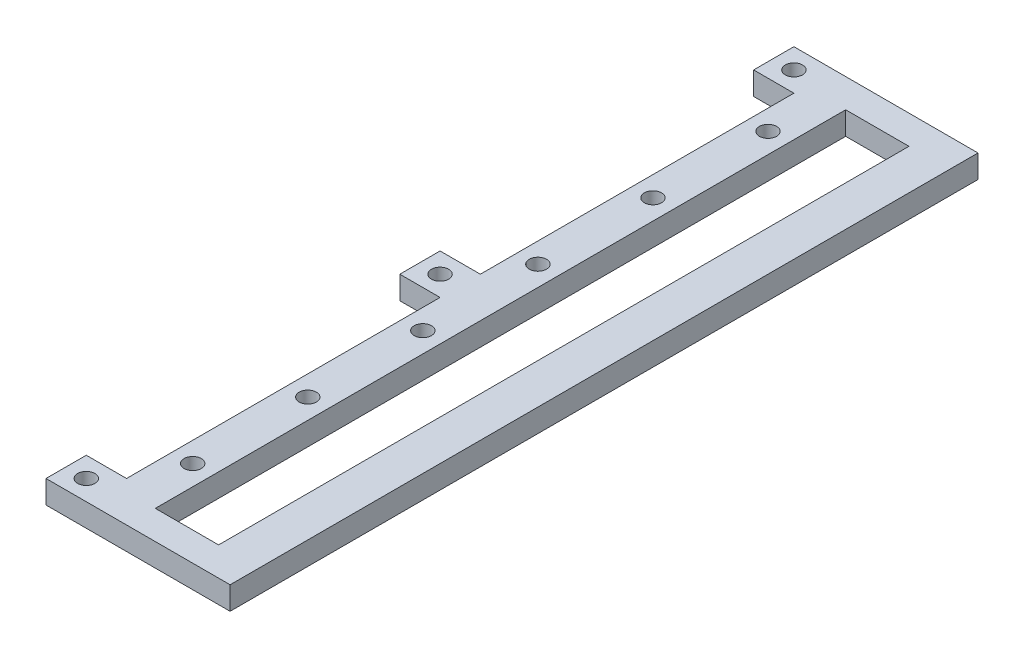
from build123d import *

# Parameters (mm, degrees)
SKETCH1_R           = 1.5
SKETCH1_W           = 11
SKETCH1_H           = 120
BOSS_EXTRUDE1_DEPTH = 4


with BuildPart() as part:
    # Sketch1 → Boss-Extrude1 (new body)
    with BuildSketch(Plane(origin=(0, 0, 0), x_dir=(1, 0, 0), z_dir=(0, 1, 0))):
        Polygon((-12.5, 65), (12.5, 65), (12.5, -65), (-12.5, -65), (-19.5, -65), (-19.5, -58), (-12.5, -58), (-12.5, -3.5), (-19.5, -3.5), (-19.5, 3.5), (-12.5, 3.5), (-12.5, 58), (-19.5, 58), (-19.5, 65), align=None)
        with Locations(Location((-9, 50, 0), (0, 0, 90))):
            Circle(SKETCH1_R, mode=Mode.SUBTRACT)
        with Locations(Location((-16, 61.5, 0), (0, 0, 270))):
            Circle(SKETCH1_R, mode=Mode.SUBTRACT)
        with Locations(Location((-16, 0, 0), (0, 0, 270))):
            Circle(SKETCH1_R, mode=Mode.SUBTRACT)
        with Locations(Location((-16, -61.5, 0), (0, 0, 90))):
            Circle(SKETCH1_R, mode=Mode.SUBTRACT)
        with Locations(Location((-9, -50, 0), (0, 0, 270))):
            Circle(SKETCH1_R, mode=Mode.SUBTRACT)
        with Locations(Location((-9, 30, 0), (0, 0, 90))):
            Circle(SKETCH1_R, mode=Mode.SUBTRACT)
        with Locations(Location((-9, 10, 0), (0, 0, 90))):
            Circle(SKETCH1_R, mode=Mode.SUBTRACT)
        with Locations(Location((-9, -10, 0), (0, 0, 90))):
            Circle(SKETCH1_R, mode=Mode.SUBTRACT)
        with Locations(Location((-9, -30, 0), (0, 0, 90))):
            Circle(SKETCH1_R, mode=Mode.SUBTRACT)
        Rectangle(SKETCH1_W, SKETCH1_H, mode=Mode.SUBTRACT)
    extrude(amount=BOSS_EXTRUDE1_DEPTH)


solid = part.part
